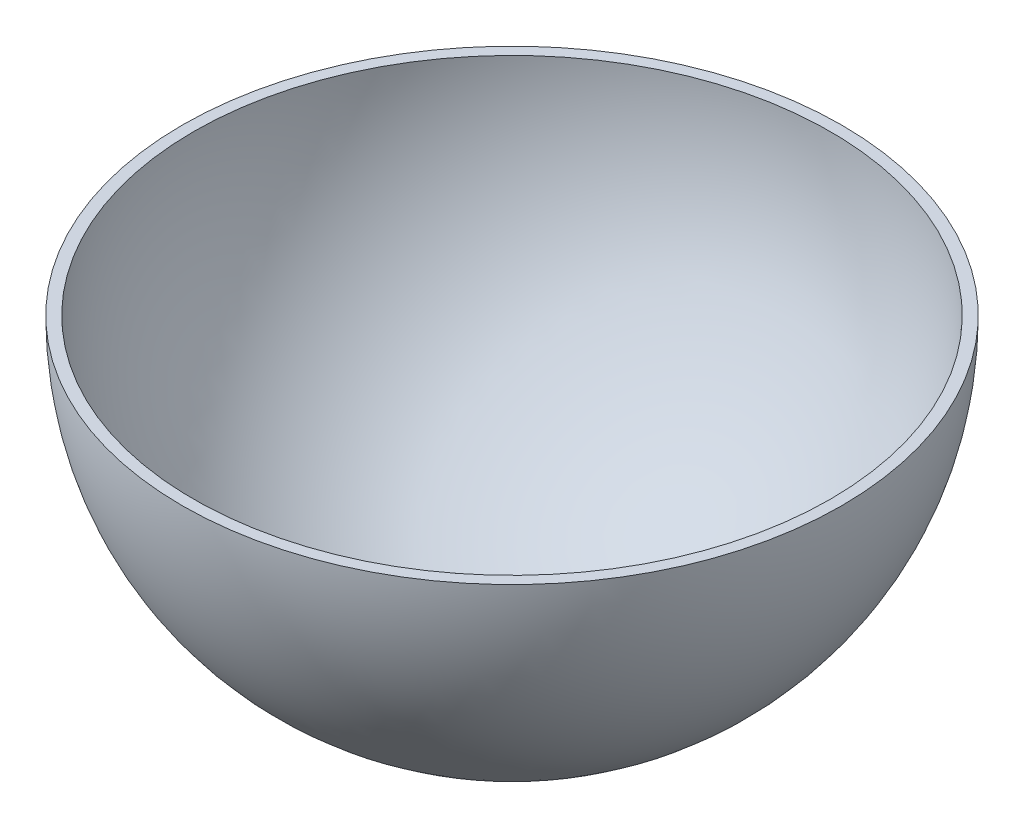
from build123d import *


with BuildPart() as part:
    # Sketch1 → Revolve4 (revolve)
    with BuildSketch(Plane.XY):
        with BuildLine():
            Line((35, 0), (33.8, 0))
            ThreePointArc((33.8, 0), (23.900209204, -23.900209204), (0, -33.8))
            Line((0, -33.8), (0, -35))
            ThreePointArc((0, -35), (24.748737342, -24.748737342), (35, 0))
        make_face()
    revolve(axis=Axis((0, 0, 0), (0, -1, 0)))


solid = part.part
